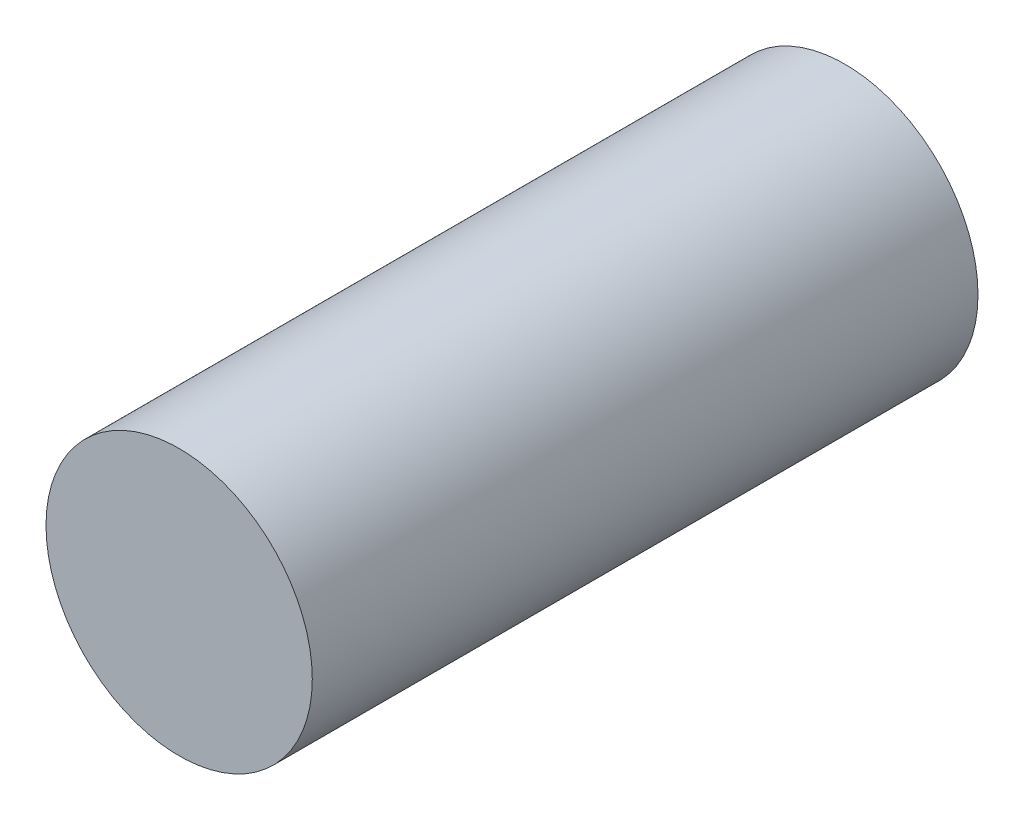
from build123d import *

# Parameters (mm, degrees)
SKETCH_1_R      = 6
EXTRUDE_1_DEPTH = 30


with BuildPart() as part:
    # 草图1 → 凸台-拉伸1 (new body)
    with BuildSketch(Plane.XY):
        Circle(SKETCH_1_R)
    extrude(amount=EXTRUDE_1_DEPTH)


solid = part.part
